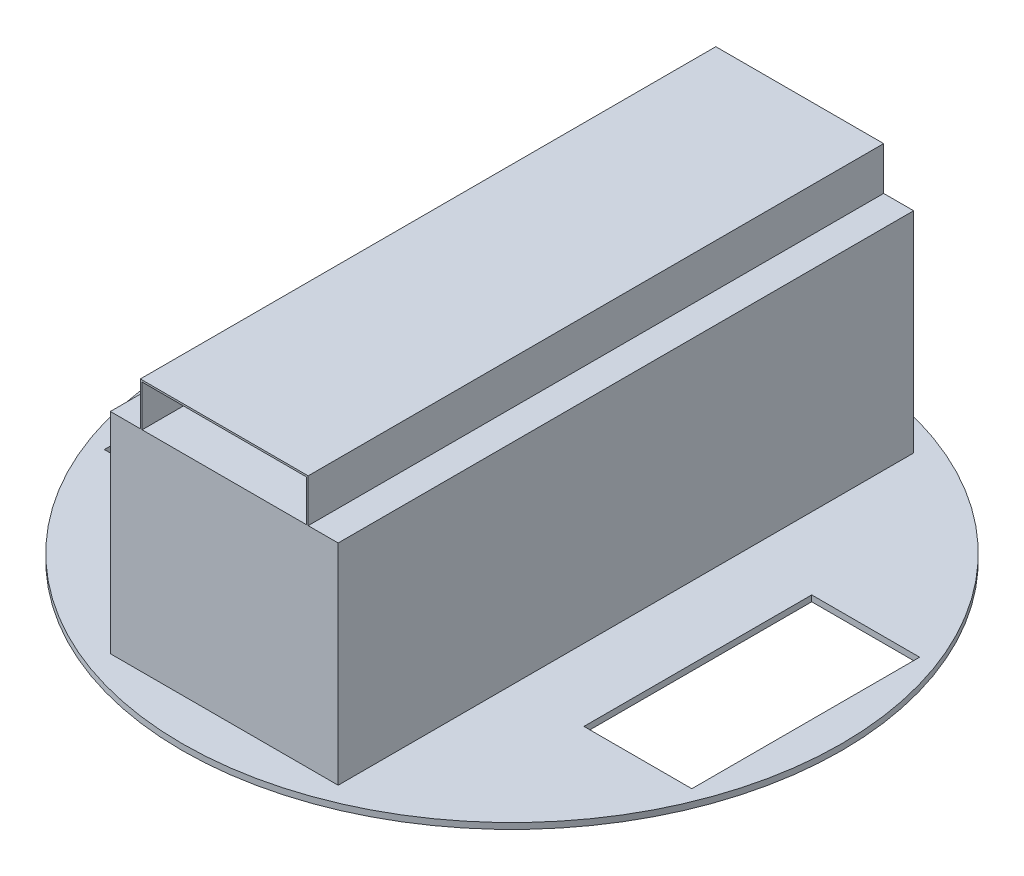
from build123d import *

# Parameters (mm, degrees)
SKETCH_1_R      = 275
SKETCH_1_W      = 90
SKETCH_1_H      = 190
EXTRUDE_1_DEPTH = 5
SKETCH_1_4_W    = 190
SKETCH_1_4_H    = 480
EXTRUDE_2_DEPTH = 180
EXTRUDE_3_DEPTH = 480
SKETCH_5_W      = 45
SKETCH_5_H      = 45
SKETCH_5_R      = 12
EXTRUDE_4_DEPTH = 2
SKETCH_5_3_R    = 12
EXTRUDE_5_DEPTH = 4


with BuildPart() as part:
    # 草图1 → 凸台-拉伸1 (new body)
    with BuildSketch(Plane(origin=(0, 0, 0), x_dir=(1, 0, 0), z_dir=(0, 1, 0))):
        with Locations(Location((0, 0, 0), (0, 0, 270))):
            Circle(SKETCH_1_R)
        with Locations((-200, 0)):
            Rectangle(SKETCH_1_W, SKETCH_1_H, mode=Mode.SUBTRACT)
        with Locations((200, 0)):
            Rectangle(SKETCH_1_W, SKETCH_1_H, mode=Mode.SUBTRACT)
    extrude(amount=EXTRUDE_1_DEPTH)

    # 草图1<4> → 凸台-拉伸2 (add)
    with BuildSketch(Plane(origin=(0, 0, 0), x_dir=(1, 0, 0), z_dir=(0, 1, 0))):
        Rectangle(SKETCH_1_4_W, SKETCH_1_4_H)
    extrude(amount=EXTRUDE_2_DEPTH)

    # 草图2 → 凸台-拉伸3 (add)
    with BuildSketch(Plane.XY.offset(240)):
        Polygon((-68.5, 214.5), (-68.5, 181.5), (-68.5, 180), (-70, 180), (-70, 216), (70, 216), (70, 180), (68.5, 180), (68.5, 181.5), (68.5, 214.5), align=None)
    extrude(amount=-EXTRUDE_3_DEPTH)

    # 草图5 → 凸台-拉伸4 (add)
    # profile 1 of 3: a face of its own
    with BuildSketch(Plane.XZ):
        with Locations((-157.292912236, 142.766592664)):
            Rectangle(SKETCH_5_W, SKETCH_5_H)
        with Locations(Location((-157.292912236, 142.766592664, 0), (0, 0, 270))):
            Circle(SKETCH_5_R, mode=Mode.SUBTRACT)
    # profile 2 of 3: a face of its own
    with BuildSketch(Plane.XZ):
        with Locations((157.292912236, 142.766592664)):
            Rectangle(SKETCH_5_W, SKETCH_5_H)
        with Locations(Location((157.292912236, 142.766592664, 0), (0, 0, 270))):
            Circle(SKETCH_5_R, mode=Mode.SUBTRACT)
    # profile 3 of 3: a face of its own
    with BuildSketch(Plane.XZ):
        with Locations((0, -194.549146173)):
            Rectangle(SKETCH_5_W, SKETCH_5_H)
        with Locations(Location((0, -194.549146173, 0), (0, 0, 270))):
            Circle(SKETCH_5_R, mode=Mode.SUBTRACT)
    extrude(amount=EXTRUDE_4_DEPTH)

    # 草图5<3> → 凸台-拉伸5 (add)
    with BuildSketch(Plane.XZ):
        with Locations(Location((-157.292912236, 142.766592664, 0), (0, 0, 270))):
            Circle(SKETCH_5_3_R)
        with Locations(Location((0, -194.549146173, 0), (0, 0, 270))):
            Circle(SKETCH_5_3_R)
        with Locations(Location((157.292912236, 142.766592664, 0), (0, 0, 270))):
            Circle(SKETCH_5_3_R)
    extrude(amount=EXTRUDE_5_DEPTH)


solid = part.part
